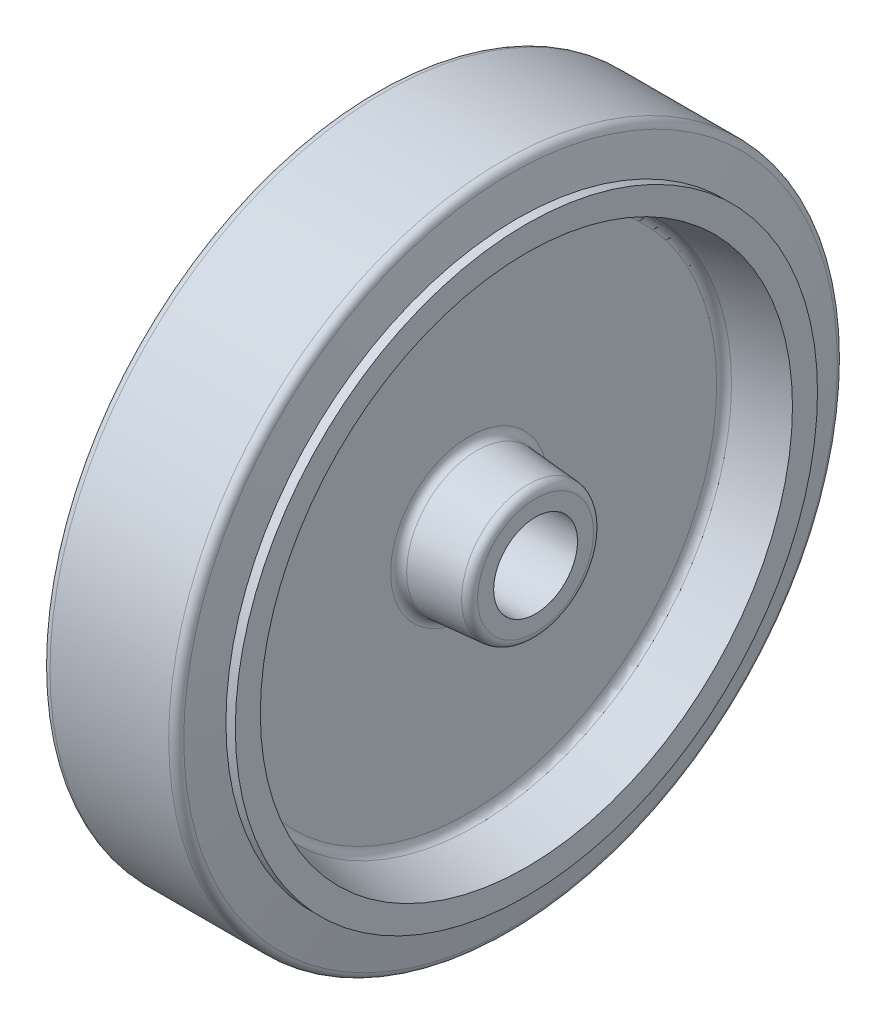
from build123d import *

# Parameters (mm, degrees)
FILLET1_R = 2


with BuildPart() as part:
    # Sketch1 → Revolve1 (revolve)
    with BuildSketch(Plane.XY, mode=Mode.PRIVATE) as revolve1_sk:
        Polygon((-15.9, -80), (15.9, -80), (17.75, -69.8), (20, -69.8), (20, -63.8), (6.3, -60.95), (6.3, -17), (22.2, -15.75), (22.2, -10.05), (-22.2, -10.05), (-22.2, -15.75), (-6.3, -17), (-6.3, -60.95), (-20, -63.8), (-20, -69.8), (-17.75, -69.8), align=None)
    revolve(revolve1_sk.sketch.rotate(Axis((0, 0, 0), (1, 0, 0)), 270), axis=Axis((0, 0, 0), (1, 0, 0)))

    # Fillet1
    fillet1_edges = [part.edges().sort_by_distance(p)[0] for p in [
        (15.9, 0, -80),
        (-15.9, 0, -80),
        (-6.3, 0, -60.95),
        (-6.3, 0, -17),
        (-22.2, 0, -15.75),
        (22.2, 0, -15.75),
        (6.3, 0, -17),
        (6.3, 0, -60.95),
    ]]
    fillet(fillet1_edges, radius=FILLET1_R)


solid = part.part
